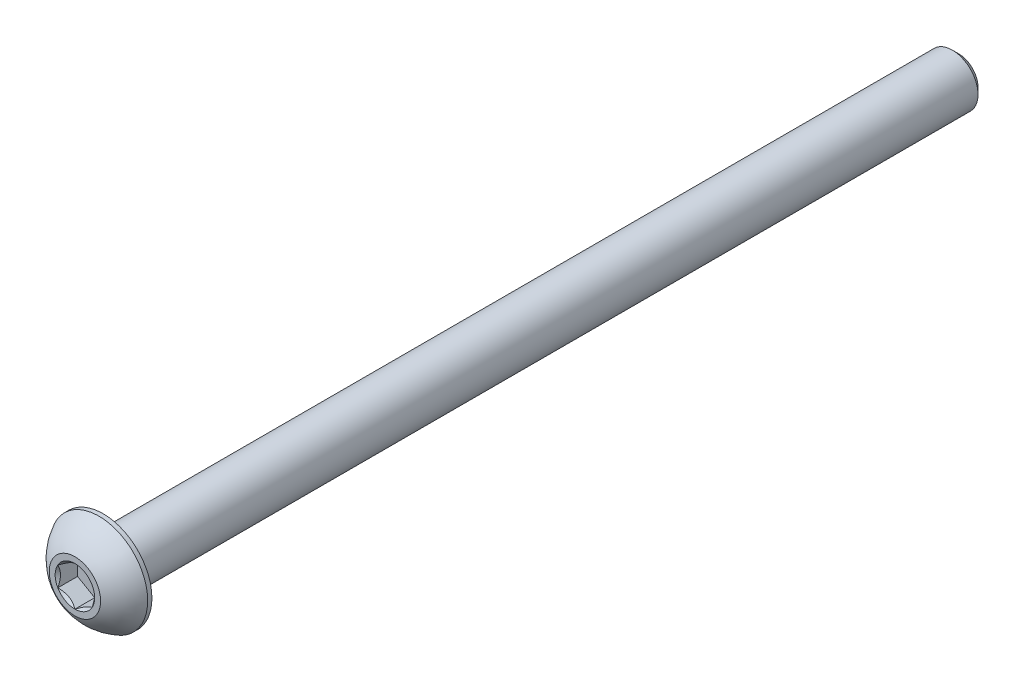
from build123d import *

# Parameters (mm, degrees)
SKETCH1_W          = 50
SKETCH1_H          = 1.5
CHAMFER1_SIZE      = 0.375
CUT_EXTRUDE2_DEPTH = 1.155


with BuildPart() as part:
    # Sketch1 → Revolve1 (revolve)
    with BuildSketch(Plane(origin=(0, 0, 0), x_dir=(0, 0, -1), z_dir=(1, 0, 0))):
        with Locations((26.65, 0.75)):
            Rectangle(SKETCH1_W, SKETCH1_H)
    revolve(axis=Axis((0, 0, -51.65), (0, 0, 1)))

    # Chamfer1
    chamfer1_edges = [part.edges().sort_by_distance(p)[0] for p in [
        (0, -1.5, -51.65),
    ]]
    chamfer(chamfer1_edges, length=CHAMFER1_SIZE)

    # Sketch7 → Revolve2 (revolve)
    with BuildSketch(Plane(origin=(0, 0, 0), x_dir=(0, 0, -1), z_dir=(1, 0, 0))):
        with BuildLine():
            Line((1.4025, 2.85), (1.65, 2.85))
            Line((1.65, 2.85), (1.65, 0))
            Line((1.65, 0), (0, 0))
            Line((0, 0), (0, 1.5))
            ThreePointArc((0, 1.5), (0.59512511, 2.285251969), (1.4025, 2.85))
        make_face()
    revolve(axis=Axis((0, 0, 0), (0, 0, -1)))

    # Sketch5 → Cut-Extrude2 (cut)
    with BuildSketch(Plane.XY):
        Polygon((1, -0.577350269), (1, 0.577350269), (0, 1.154700538), (-1, 0.577350269), (-1, -0.577350269), (0, -1.154700538), align=None)
    extrude(amount=-CUT_EXTRUDE2_DEPTH, mode=Mode.SUBTRACT)

    # Cut-Extrude3 cone 1 section (through the dimple's axis) → Cut-Extrude3 (revolve, cut)
    with BuildSketch(Plane(origin=(0, 0, 0), x_dir=(0, -1, 0), z_dir=(1, 0, 0))):
        Polygon((0, 0), (1.154700538, 0), (0, 1.154700538), align=None)
    revolve(axis=Axis((0, 0, 0), (0, 0, -1)), mode=Mode.SUBTRACT)


solid = part.part
